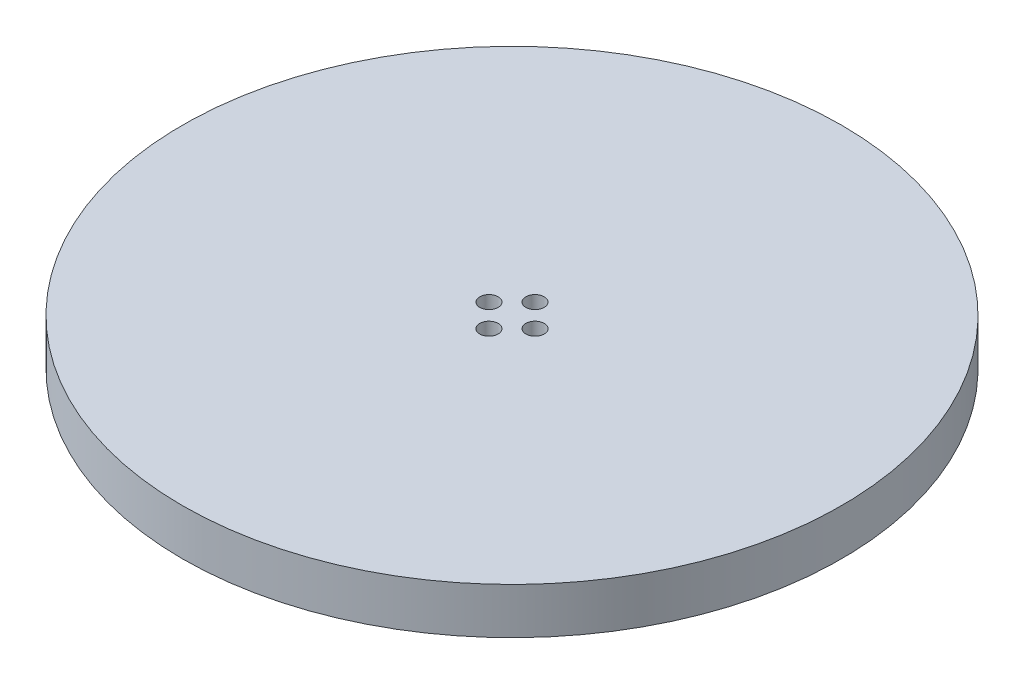
from build123d import *

# Parameters (mm, degrees)
SKETCH_6_R      = 71.5
SKETCH_6_R_2    = 2
EXTRUDE_2_DEPTH = 10


with BuildPart() as part:
    # 草圖6 → 填料-伸長2 (new body)
    with BuildSketch(Plane(origin=(0, 0, 0), x_dir=(1, 0, 0), z_dir=(0, 1, 0))):
        Circle(SKETCH_6_R)
        with Locations((0, -5)):
            Circle(SKETCH_6_R_2, mode=Mode.SUBTRACT)
        with Locations((-5, 0)):
            Circle(SKETCH_6_R_2, mode=Mode.SUBTRACT)
        with Locations((5, 0)):
            Circle(SKETCH_6_R_2, mode=Mode.SUBTRACT)
        with Locations((0, 5)):
            Circle(SKETCH_6_R_2, mode=Mode.SUBTRACT)
    extrude(amount=EXTRUDE_2_DEPTH)


solid = part.part
